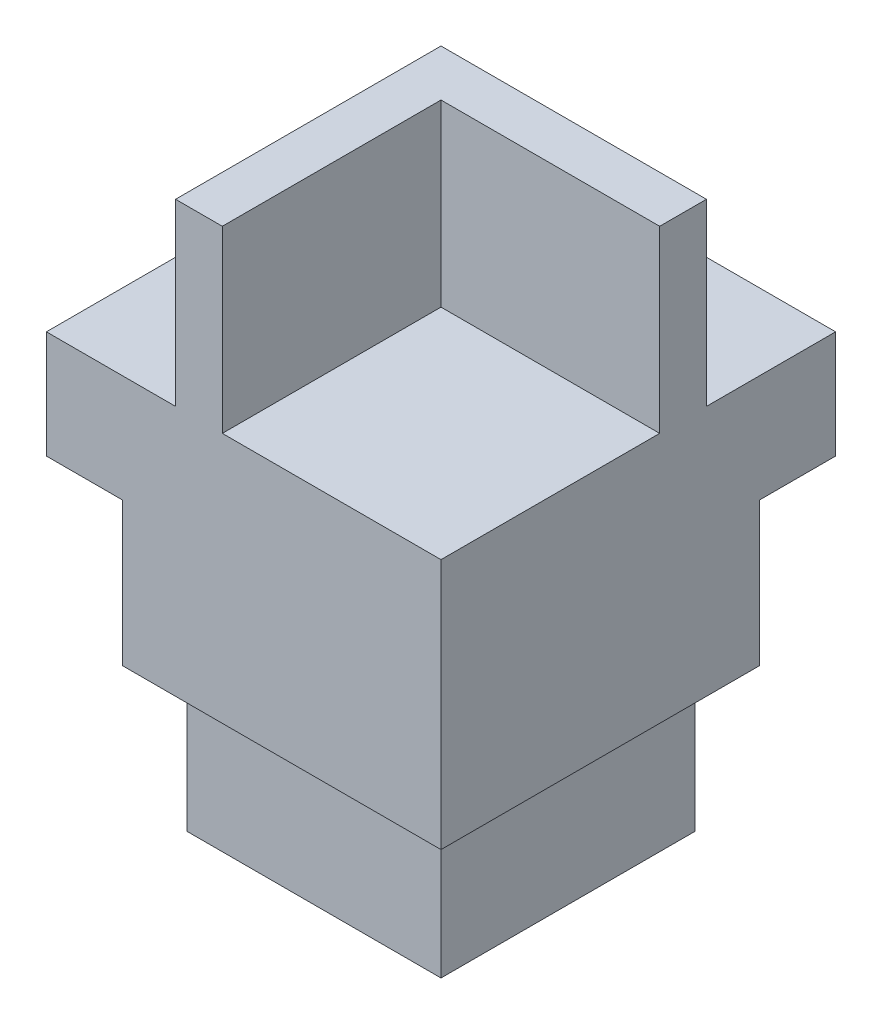
from build123d import *

# Parameters (mm, degrees)
SKETCH7_W           = 27.5
SKETCH7_H           = 27.5
BOSS_EXTRUDE6_DEPTH = 40
SKETCH8_W           = 15.24
SKETCH8_H           = 15.24
CUT_EXTRUDE2_DEPTH  = 12.5
CUT_EXTRUDE3_DEPTH  = 20
SKETCH10_W          = 22.2
SKETCH10_H          = 22.2
SKETCH10_W_2        = 17.7
SKETCH10_H_2        = 17.7
CUT_EXTRUDE4_DEPTH  = 10
CUT_EXTRUDE5_DEPTH  = 12.5


with BuildPart() as part:
    # Sketch7 → Boss-Extrude6 (new body)
    with BuildSketch(Plane(origin=(0, 0, 0), x_dir=(1, 0, 0), z_dir=(0, 1, 0))):
        with Locations((-1.790038454, -39.090727751)):
            Rectangle(SKETCH7_W, SKETCH7_H)
    extrude(amount=BOSS_EXTRUDE6_DEPTH)

    # Sketch8 → Cut-Extrude2 (cut)
    with BuildSketch(Plane(origin=(0, 40, 0), x_dir=(1, 0, 0), z_dir=(0, 1, 0))):
        with Locations((4.339961546, -45.220727751)):
            Rectangle(SKETCH8_W, SKETCH8_H)
    extrude(amount=-CUT_EXTRUDE2_DEPTH, mode=Mode.SUBTRACT)

    # Sketch9 → Cut-Extrude3 (cut)
    with BuildSketch(Plane.XZ):
        Polygon((-10.240038454, 30.640727751), (-10.240038454, 52.840727751), (-15.540038454, 52.840727751), (-15.540038454, 25.340727751), (11.959961546, 25.340727751), (11.959961546, 30.640727751), align=None)
    extrude(amount=-CUT_EXTRUDE3_DEPTH, mode=Mode.SUBTRACT)

    # Sketch10 → Cut-Extrude4 (cut)
    with BuildSketch(Plane.XZ):
        with Locations((0.859961546, 41.740727751)):
            Rectangle(SKETCH10_W, SKETCH10_H)
        with Locations((0.859961546, 41.740727751)):
            Rectangle(SKETCH10_W_2, SKETCH10_H_2, mode=Mode.SUBTRACT)
    extrude(amount=-CUT_EXTRUDE4_DEPTH, mode=Mode.SUBTRACT)

    # Sketch11 → Cut-Extrude5 (cut)
    with BuildSketch(Plane(origin=(0, 40, 0), x_dir=(1, 0, 0), z_dir=(0, 1, 0))):
        Polygon((11.959961546, -34.340727751), (11.959961546, -25.340727751), (-4.564600262, -25.340727751), (-10.557653768, -25.340727751), (-15.540038454, -25.340727751), (-15.540038454, -52.840727751), (-6.540038454, -52.840727751), (-6.540038454, -34.340727751), align=None)
    extrude(amount=-CUT_EXTRUDE5_DEPTH, mode=Mode.SUBTRACT)


solid = part.part
